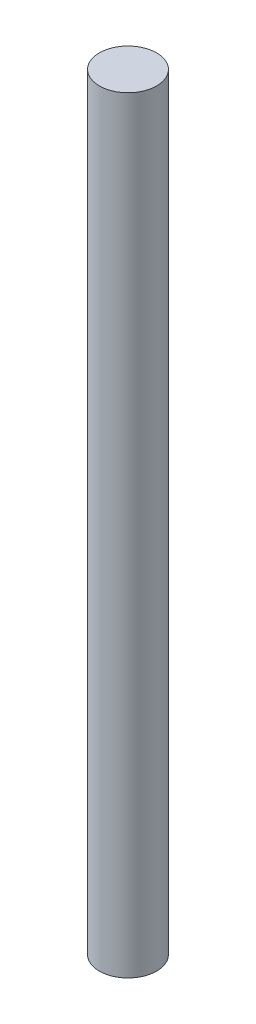
from build123d import *

# Parameters (mm, degrees)
SKETCH1_R           = 6.35
BOSS_EXTRUDE1_DEPTH = 85


with BuildPart() as part:
    # Sketch1 → Boss-Extrude1 (new, symmetric)
    with BuildSketch(Plane(origin=(0, 0, 0), x_dir=(1, 0, 0), z_dir=(0, 1, 0))):
        with Locations(Location((0, 0, 0), (0, 0, 270))):
            Circle(SKETCH1_R)
    extrude(amount=BOSS_EXTRUDE1_DEPTH, both=True)


solid = part.part
